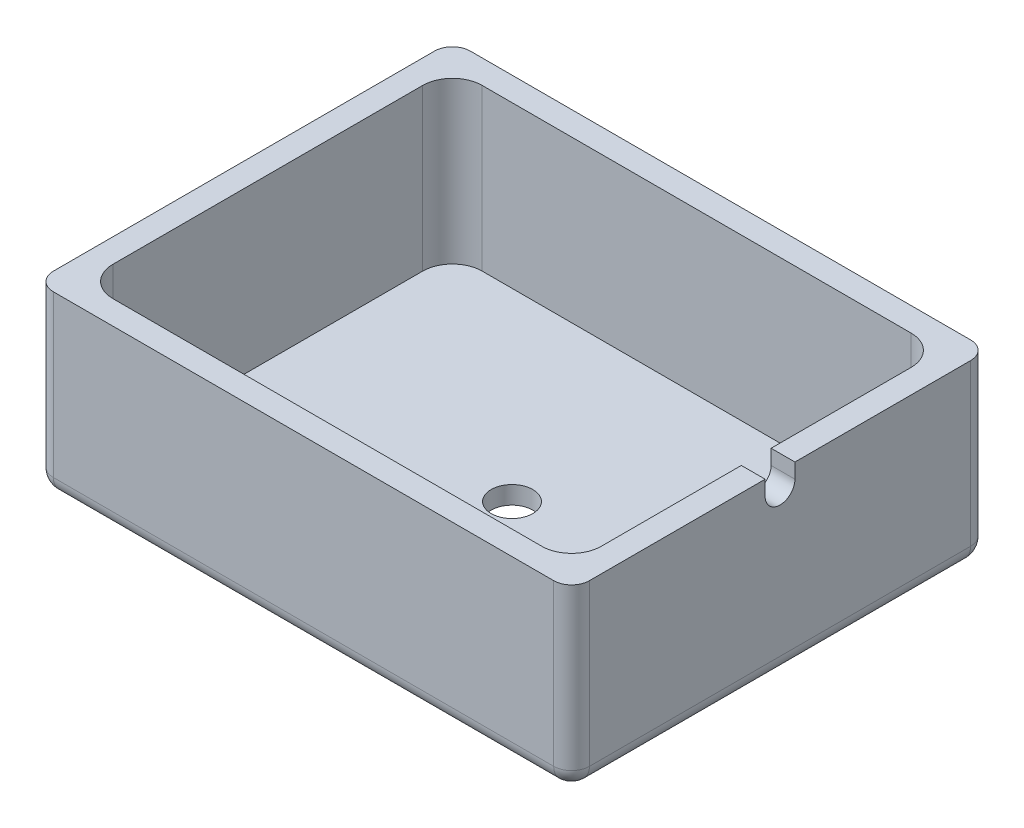
from build123d import *

# Parameters (mm, degrees)
ESBO_O1_W                = 90
ESBO_O1_H                = 70
ESBO_O1_R                = 3.5
RESSALTO_EXTRUS_O1_DEPTH = 3
ESBO_O1_3_W              = 90
ESBO_O1_3_H              = 70
ESBO_O1_3_W_2            = 82
ESBO_O1_3_H_2            = 62
RESSALTO_EXTRUS_O2_DEPTH = 30
FILETE1_R                = 3
CORTE_EXTRUS_O1_REACH    = 103.119
FILETE2_R                = 5


with BuildPart() as part:
    # Esboço1 → Ressalto-extrusão1 (new body)
    with BuildSketch(Plane(origin=(0, 0, 0), x_dir=(1, 0, 0), z_dir=(0, 1, 0))):
        Rectangle(ESBO_O1_W, ESBO_O1_H)
        Circle(ESBO_O1_R, mode=Mode.SUBTRACT)
    extrude(amount=RESSALTO_EXTRUS_O1_DEPTH)

    # Esboço1<3> → Ressalto-extrusão2 (add)
    with BuildSketch(Plane(origin=(0, 0, 0), x_dir=(1, 0, 0), z_dir=(0, 1, 0))):
        Rectangle(ESBO_O1_3_W, ESBO_O1_3_H)
        Rectangle(ESBO_O1_3_W_2, ESBO_O1_3_H_2, mode=Mode.SUBTRACT)
    extrude(amount=RESSALTO_EXTRUS_O2_DEPTH)

    # Filete1
    filete1_edges = [part.edges().sort_by_distance(p)[0] for p in [
        (45, 15, 35),
        (45, 15, -35),
        (-45, 15, 35),
        (-45, 15, -35),
        (45, 0, 0),
        (0, 0, -35),
        (0, 0, 35),
        (-45, 0, 0),
    ]]
    fillet(filete1_edges, radius=FILETE1_R)

    # Esboço2 → Corte-extrusão1 (cut, up to next)
    with BuildSketch(Plane(origin=(45, 0, 0), x_dir=(0, 0, -1), z_dir=(1, 0, 0)), mode=Mode.PRIVATE) as corte_extrus_o1_sk1:
        with BuildLine():
            Line((-2.5, 27.5), (-2.5, 30))
            Line((-2.5, 30), (2.5, 30))
            Line((2.5, 30), (2.5, 27.5))
            ThreePointArc((2.5, 27.5), (0, 25), (-2.5, 27.5))
        make_face()
    corte_extrus_o1_tool1 = extrude(corte_extrus_o1_sk1.sketch, amount=-CORTE_EXTRUS_O1_REACH, mode=Mode.PRIVATE) & part.part
    add(corte_extrus_o1_tool1.solids().sort_by_distance((45, 27.733375, 0))[0], mode=Mode.SUBTRACT)

    # Filete2
    filete2_edges = [part.edges().sort_by_distance(p)[0] for p in [
        (41, 16.5, 31),
        (-41, 16.5, 31),
        (41, 16.5, -31),
        (-41, 16.5, -31),
    ]]
    fillet(filete2_edges, radius=FILETE2_R)


solid = part.part
